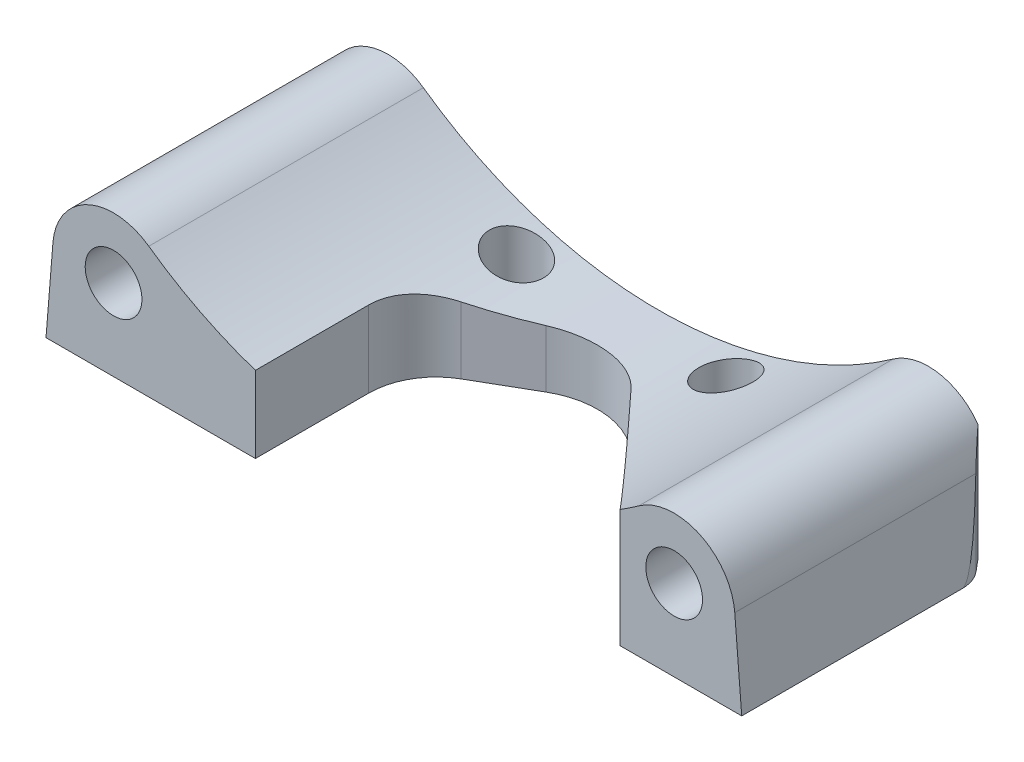
from build123d import *

# Parameters (mm, degrees)
SKETCH1_R           = 4.2
BOSS_EXTRUDE1_DEPTH = 40.65
SKETCH2_R           = 4.2
BOSS_EXTRUDE2_DEPTH = 18
SKETCH3_R           = 4
CUT_EXTRUDE1_DEPTH  = 68.774792512
SKETCH4_R           = 2.6
CUT_EXTRUDE2_DEPTH  = 6
CHAMFER1_SIZE       = 1
CUT_EXTRUDE3_DEPTH  = 68.774792572


with BuildPart() as part:
    # Sketch1 → Boss-Extrude1 (new body)
    with BuildSketch(Plane.XY):
        with BuildLine():
            Line((-48.970703673, 12.725586394), (-50, 0))
            Line((-50, 0), (50, 0))
            Line((50, 0), (48.970703673, 12.725586394))
            ThreePointArc((48.970703673, 12.725586394), (43.799691423, 20.158574942), (34.782608696, 19.333404937))
            ThreePointArc((34.782608696, 19.333404937), (0, 8.222771187), (-34.782608696, 19.333404937))
            ThreePointArc((-34.782608696, 19.333404937), (-43.799691423, 20.158574942), (-48.970703673, 12.725586394))
        make_face()
        with Locations((-40, 12)):
            Circle(SKETCH1_R, mode=Mode.SUBTRACT)
        with Locations((40, 12)):
            Circle(SKETCH1_R, mode=Mode.SUBTRACT)
    extrude(amount=BOSS_EXTRUDE1_DEPTH)

    # Sketch2 → Boss-Extrude2 (add)
    with BuildSketch(Plane(origin=(0, 0, 0), x_dir=(-1, 0, 0), z_dir=(0, 0, -1))):
        with Locations((-40, 12)):
            Circle(SKETCH2_R)
        with Locations((40, 12)):
            Circle(SKETCH2_R)
    extrude(amount=-BOSS_EXTRUDE2_DEPTH)

    # Sketch3 → Cut-Extrude1 (cut, through all)
    with BuildSketch(Plane.XZ):
        with Locations((-15.5, 5.5)):
            Circle(SKETCH3_R)
        with Locations((15.5, 5.5)):
            Circle(SKETCH3_R)
        with BuildLine():
            Line((8.764674023, 12.803629506), (32, 37.65))
            Line((32, 37.65), (50, 37.65))
            Line((50, 37.65), (50, 40.65))
            Line((50, 40.65), (-19, 40.65))
            Line((-19, 40.65), (-19, 23.886751346))
            ThreePointArc((-19, 23.886751346), (-17.660254038, 18.886751346), (-14, 15.226497308))
            Line((-14, 15.226497308), (-6, 10.607695155))
            ThreePointArc((-6, 10.607695155), (1.765329298, 9.130559724), (8.764674023, 12.803629506))
        make_face()
    extrude(amount=-CUT_EXTRUDE1_DEPTH, mode=Mode.SUBTRACT)

    # Sketch4 → Cut-Extrude2 (cut)
    with BuildSketch(Plane.XZ):
        with Locations((-32, 27.65)):
            Circle(SKETCH4_R)
        with Locations((-45, 5)):
            Circle(SKETCH4_R)
        with Locations((32, 27.65)):
            Circle(SKETCH4_R)
        with Locations((45, 5)):
            Circle(SKETCH4_R)
    extrude(amount=-CUT_EXTRUDE2_DEPTH, mode=Mode.SUBTRACT)

    # Chamfer1
    chamfer1_edges = [part.edges().sort_by_distance(p)[0] for p in [
        (-34.6, 0, 27.65),
        (-47.6, 0, 5),
        (29.4, 0, 27.65),
        (42.4, 0, 5),
    ]]
    chamfer(chamfer1_edges, length=CHAMFER1_SIZE)

    # Sketch5 → Cut-Extrude3 (cut, through all)
    with BuildSketch(Plane.XZ):
        with BuildLine():
            Line((-50, 5), (-50, 0))
            Line((-50, 0), (-47.331538291, 0))
            Line((-47.331538291, 0), (-48.830222216, 1.786061952))
            ThreePointArc((-48.830222216, 1.786061952), (-49.698463104, 3.289899283), (-50, 5))
        make_face()
        with BuildLine():
            Line((48.830222216, 1.786061952), (47.331538291, 0))
            Line((47.331538291, 0), (50, 0))
            Line((50, 0), (50, 5))
            ThreePointArc((50, 5), (49.698463104, 3.289899283), (48.830222216, 1.786061952))
        make_face()
    extrude(amount=-CUT_EXTRUDE3_DEPTH, mode=Mode.SUBTRACT)


solid = part.part
